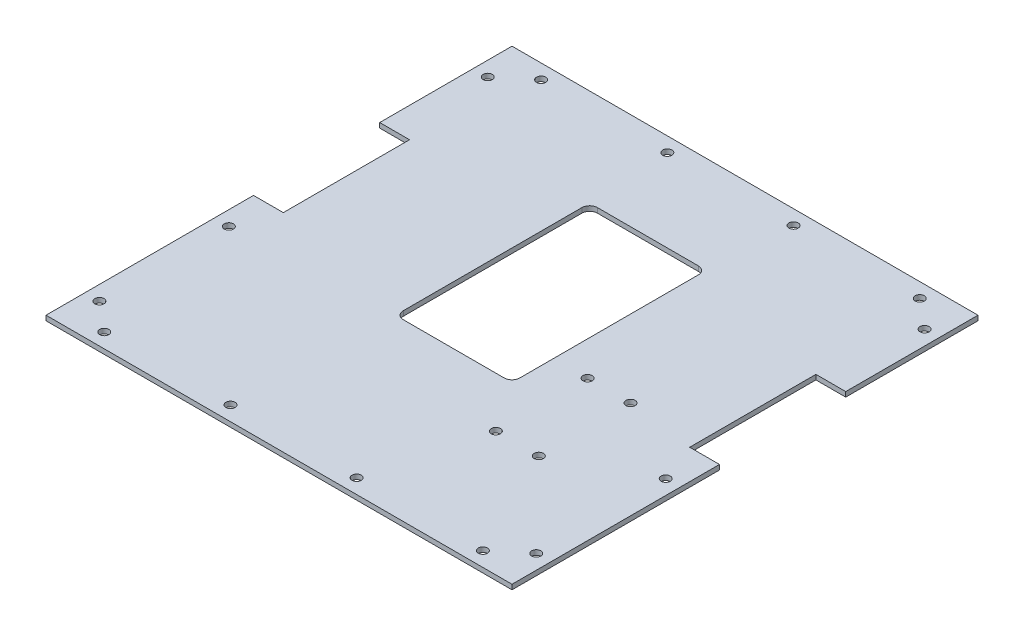
from build123d import *

# Parameters (mm, degrees)
SKETCH2_W             = 152.4
SKETCH2_H             = 152.4
BOSS_EXTRUDE1_DEPTH   = 1.5875
F_3_0MM_DOWEL_HOLE1_D = 3
F_3_0MM_DOWEL_HOLE2_D = 3
LPATTERN1_COUNT       = 4
LPATTERN1_PITCH       = 42.333333333
LPATTERN2_COUNT       = 4
LPATTERN2_PITCH       = 41.275
SKETCH12_W            = 38.1
SKETCH12_H            = 63.5
CUT_EXTRUDE1_DEPTH    = 2.54
FILLET2_R             = 2.54
SKETCH13_W            = 9.75
SKETCH13_H            = 41.28
CUT_EXTRUDE2_DEPTH    = 216.531993347
SKETCH14_R            = 1.5
CUT_EXTRUDE3_DEPTH    = 10


with BuildPart() as part:
    # Sketch2 → Boss-Extrude1 (new body)
    with BuildSketch(Plane(origin=(0, 0, 0), x_dir=(1, 0, 0), z_dir=(0, 1, 0))):
        with Locations((76.2, 76.2)):
            Rectangle(SKETCH2_W, SKETCH2_H)
    extrude(amount=BOSS_EXTRUDE1_DEPTH)

    # Ø3.0mm Dowel Hole1 (through all)
    with Locations(Plane(origin=(0, 1.5875, 0), x_dir=(1, 0, 0), z_dir=(0, 1, 0))):
        with Locations((14.2875, 147.6375), (14.2875, 4.7625)):
            f_3_0mm_dowel_hole1 = Hole(F_3_0MM_DOWEL_HOLE1_D / 2)

    # Ø3.0mm Dowel Hole2 (through all)
    with Locations(Plane(origin=(0, 1.5875, 0), x_dir=(1, 0, 0), z_dir=(0, 1, 0))):
        with Locations((4.7625, 139.7), (147.6375, 139.7)):
            f_3_0mm_dowel_hole2 = Hole(F_3_0MM_DOWEL_HOLE2_D / 2)

    # LPattern1: Ø3.0mm Dowel Hole2 ×4, 1 skipped
    with Locations(*[(0, 0, i * LPATTERN1_PITCH) for i in range(1, LPATTERN1_COUNT) if i not in (1,)]):
        add(f_3_0mm_dowel_hole2, mode=Mode.SUBTRACT)

    # LPattern2: Ø3.0mm Dowel Hole1 ×4
    with Locations(*[(i * LPATTERN2_PITCH, 0, 0) for i in range(1, LPATTERN2_COUNT)]):
        add(f_3_0mm_dowel_hole1, mode=Mode.SUBTRACT)

    # Sketch12 → Cut-Extrude1 (cut)
    with BuildSketch(Plane(origin=(0, 1.5875, 0), x_dir=(1, 0, 0), z_dir=(0, 1, 0))):
        with Locations((76.2, 88.9)):
            Rectangle(SKETCH12_W, SKETCH12_H)
    extrude(amount=-CUT_EXTRUDE1_DEPTH, mode=Mode.SUBTRACT)

    # Fillet2
    fillet2_edges = [part.edges().sort_by_distance(p)[0] for p in [
        (95.25, 0.79375, -120.65),
        (95.25, 0.79375, -57.15),
        (57.15, 0.79375, -57.15),
        (57.15, 0.79375, -120.65),
    ]]
    fillet(fillet2_edges, radius=FILLET2_R)

    # Sketch13 → Cut-Extrude2 (cut, through all)
    with BuildSketch(Plane(origin=(0, 1.5875, 0), x_dir=(1, 0, 0), z_dir=(0, 1, 0))):
        with Locations((147.525, 88.5)):
            Rectangle(SKETCH13_W, SKETCH13_H)
        with Locations((4.875, 88.5)):
            Rectangle(SKETCH13_W, SKETCH13_H)
    extrude(amount=-CUT_EXTRUDE2_DEPTH, mode=Mode.SUBTRACT)

    # Sketch14 → Cut-Extrude3 (cut)
    with BuildSketch(Plane.XZ):
        with Locations(Location((120.450623047, -40.719396702, 0), (0, 0, 270))):
            Circle(SKETCH14_R)
        with Locations(Location((106.400623047, -40.719396702, 0), (0, 0, 270))):
            Circle(SKETCH14_R)
        with Locations(Location((106.400623047, -70.719396702, 0), (0, 0, 270))):
            Circle(SKETCH14_R)
        with Locations(Location((120.450623047, -70.719396702, 0), (0, 0, 270))):
            Circle(SKETCH14_R)
    extrude(amount=-CUT_EXTRUDE3_DEPTH, mode=Mode.SUBTRACT)


solid = part.part
